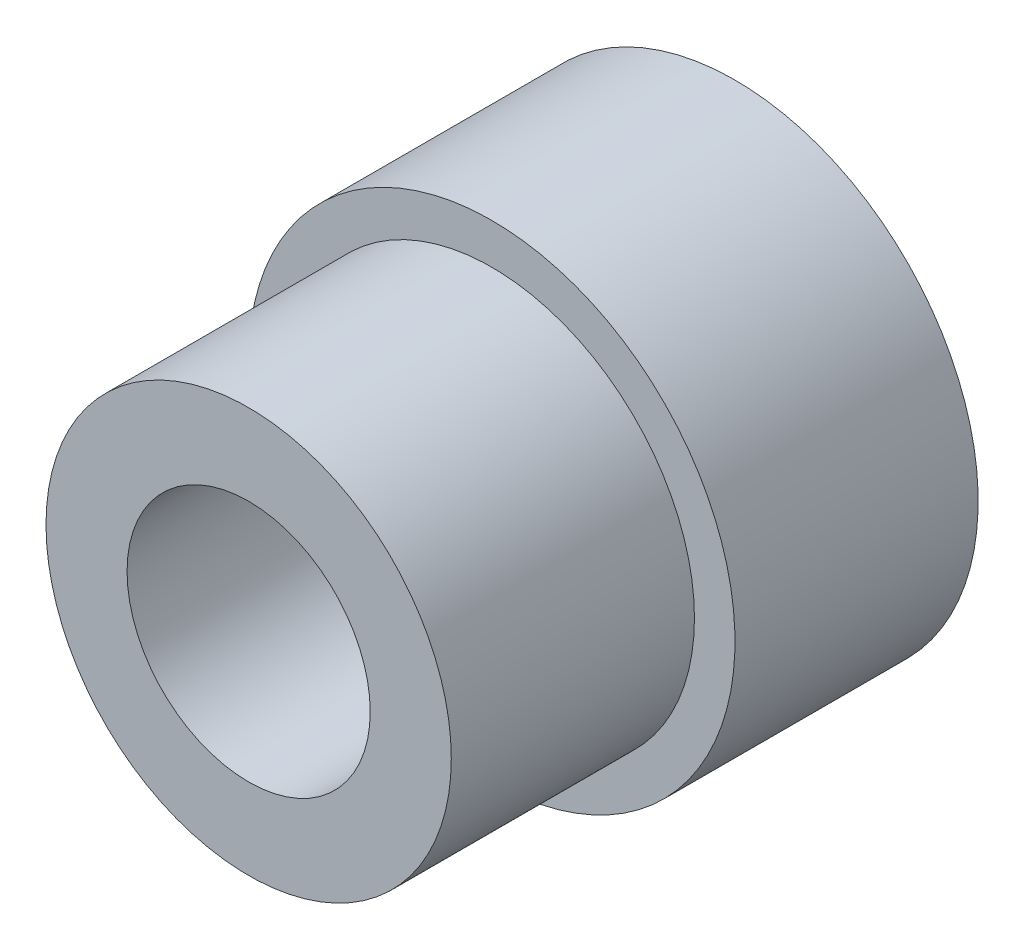
from build123d import *

# Parameters (mm, degrees)
SKETCH1_R           = 25
SKETCH1_R_2         = 15
BOSS_EXTRUDE1_DEPTH = 30
SKETCH2_R           = 30
BOSS_EXTRUDE2_DEPTH = 30
CUT_EXTRUDE1_START  = -30
SKETCH3_R           = 15
CUT_EXTRUDE1_DEPTH  = 30


with BuildPart() as part:
    # Sketch1 → Boss-Extrude1 (new body)
    with BuildSketch(Plane.XY):
        Circle(SKETCH1_R)
        Circle(SKETCH1_R_2, mode=Mode.SUBTRACT)
    extrude(amount=BOSS_EXTRUDE1_DEPTH)

    # Sketch2 → Boss-Extrude2 (add)
    with BuildSketch(Plane(origin=(0, 0, 0), x_dir=(-1, 0, 0), z_dir=(0, 0, -1))):
        Circle(SKETCH2_R)
    extrude(amount=BOSS_EXTRUDE2_DEPTH)

    # Sketch3 → Cut-Extrude1 (cut)
    with BuildSketch(Plane.XY.offset(CUT_EXTRUDE1_START)):
        Circle(SKETCH3_R)
    extrude(amount=CUT_EXTRUDE1_DEPTH, mode=Mode.SUBTRACT)


solid = part.part
